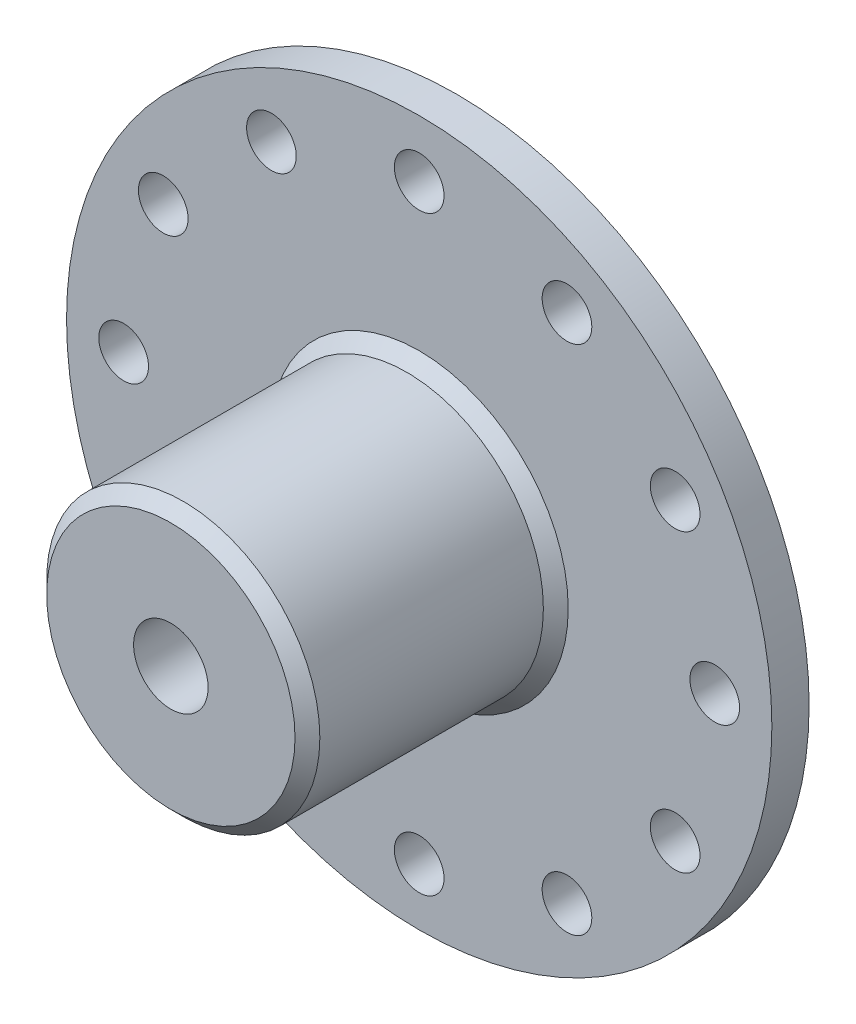
from build123d import *

# Parameters (mm, degrees)
SKETCH1_R           = 28.4
BOSS_EXTRUDE1_DEPTH = 3
SKETCH2_R           = 11
BOSS_EXTRUDE2_DEPTH = 20
SKETCH3_R           = 3
CUT_EXTRUDE1_DEPTH  = 47.283042251
SKETCH4_R           = 2
CUT_EXTRUDE2_DEPTH  = 15
CHAMFER1_SIZE       = 1
SKETCH5_R           = 2
CUT_EXTRUDE5_DEPTH  = 45.867805875
CIRPATTERN2_COUNT   = 12


with BuildPart() as part:
    # Sketch1 → Boss-Extrude1 (new body)
    with BuildSketch(Plane.XY):
        Circle(SKETCH1_R)
    extrude(amount=BOSS_EXTRUDE1_DEPTH)

    # Sketch2 → Boss-Extrude2 (add)
    with BuildSketch(Plane.XY.offset(3)):
        Circle(SKETCH2_R)
    extrude(amount=BOSS_EXTRUDE2_DEPTH)

    # Sketch3 → Cut-Extrude1 (cut, through all)
    with BuildSketch(Plane.XY.offset(23)):
        Circle(SKETCH3_R)
    extrude(amount=-CUT_EXTRUDE1_DEPTH, mode=Mode.SUBTRACT)

    # Sketch4 → Cut-Extrude2 (cut)
    with BuildSketch(Plane(origin=(0, 0, 0), x_dir=(1, 0, 0), z_dir=(0, 1, 0))):
        with Locations(Location((0, -15, 0), (0, 0, 270))):
            Circle(SKETCH4_R)
    extrude(amount=-CUT_EXTRUDE2_DEPTH, mode=Mode.SUBTRACT)

    # Chamfer1
    chamfer1_edges = [part.edges().sort_by_distance(p)[0] for p in [
        (-11, 0, 3),
        (-11, 0, 23),
    ]]
    chamfer(chamfer1_edges, length=CHAMFER1_SIZE)

    # Sketch5 → Cut-Extrude5 (cut, through all)
    with BuildSketch(Plane.XY.offset(3)):
        with Locations((11.9, 20.61140461)):
            Circle(SKETCH5_R)
    cut_extrude5 = extrude(amount=-CUT_EXTRUDE5_DEPTH, mode=Mode.SUBTRACT)

    # CirPattern2: Cut-Extrude5 ×12 about axis
    cirpattern2_axis = Axis((0, 0, 0), (0, 0, 1))
    for i in range(1, CIRPATTERN2_COUNT):
        add(cut_extrude5.rotate(cirpattern2_axis, i * 360 / CIRPATTERN2_COUNT), mode=Mode.SUBTRACT)


solid = part.part
